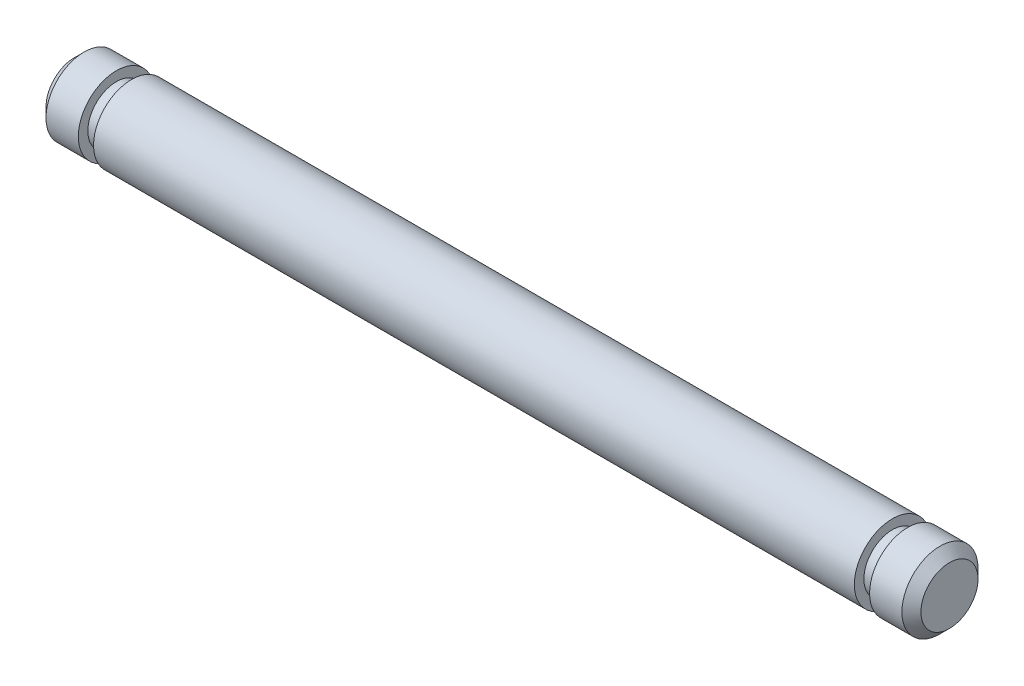
from build123d import *

# Parameters (mm, degrees)
SKETCH1_R           = 2
BOSS_EXTRUDE1_DEPTH = 23
CHAMFER1_SIZE       = 0.5
CUT_EXTRUDE1_START  = -3
SKETCH2_R           = 2
SKETCH2_R_2         = 1.5
CUT_EXTRUDE1_DEPTH  = 0.8


with BuildPart() as part:
    # Sketch1 → Boss-Extrude1 (new, symmetric)
    with BuildSketch(Plane(origin=(0, 0, 0), x_dir=(0, 0, -1), z_dir=(1, 0, 0))):
        Circle(SKETCH1_R)
    extrude(amount=BOSS_EXTRUDE1_DEPTH, both=True)

    # Chamfer1
    chamfer1_edges = [part.edges().sort_by_distance(p)[0] for p in [
        (-23, 0, 2),
        (23, 0, 2),
    ]]
    chamfer(chamfer1_edges, length=CHAMFER1_SIZE)

    # Sketch2 → Cut-Extrude1 (cut)
    with BuildSketch(Plane.ZY.offset(23).offset(CUT_EXTRUDE1_START)):
        Circle(SKETCH2_R)
        Circle(SKETCH2_R_2, mode=Mode.SUBTRACT)
    cut_extrude1 = extrude(amount=CUT_EXTRUDE1_DEPTH, mode=Mode.SUBTRACT)

    # Mirror2: Cut-Extrude1 across plane
    add(cut_extrude1.mirror(Plane(origin=(0, 0, 0), x_dir=(0, 0, 1), z_dir=(1, 0, 0))), mode=Mode.SUBTRACT)


solid = part.part
